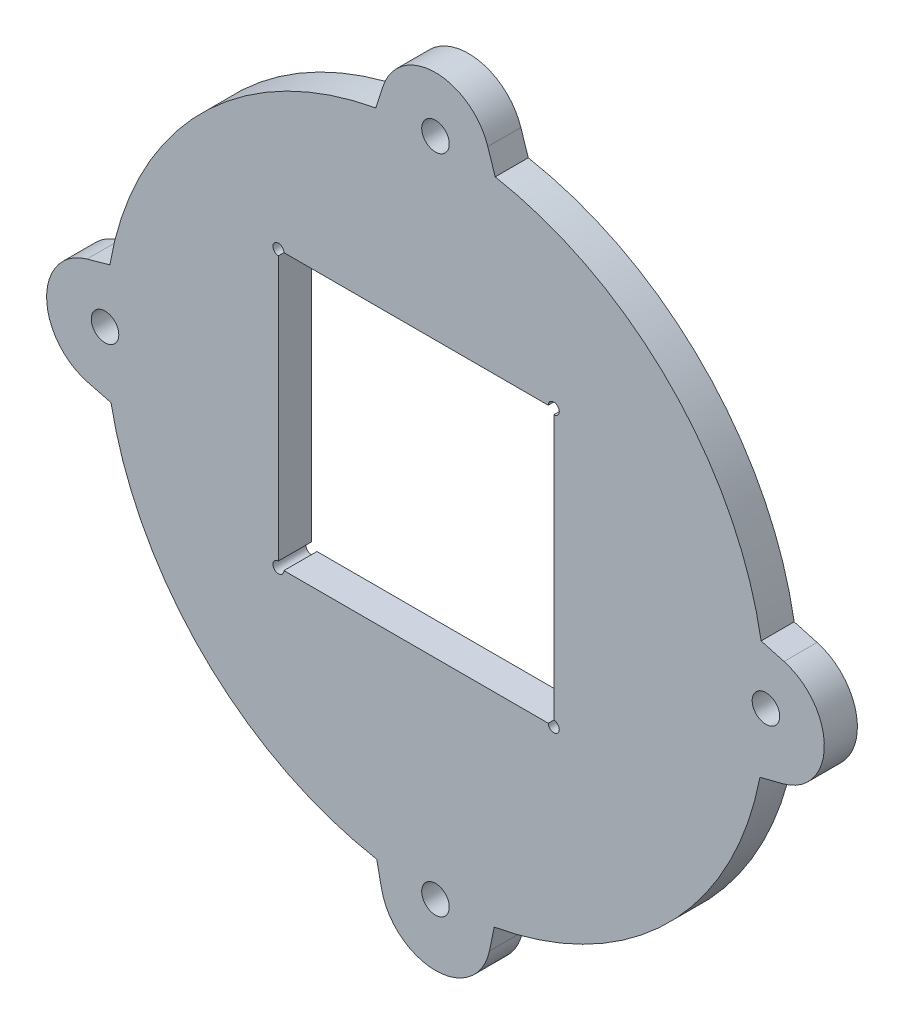
from build123d import *

# Parameters (mm, degrees)
SKETCH1_R           = 1.25
SKETCH1_W           = 25
SKETCH1_H           = 25
BOSS_EXTRUDE1_DEPTH = 3
SKETCH2_R           = 0.5
CUT_EXTRUDE1_DEPTH  = 10


with BuildPart() as part:
    # Sketch1 → Boss-Extrude1 (new body)
    with BuildSketch(Plane.XY):
        with BuildLine():
            Line((-33.493285167, 0.446508601), (-31.415510561, 1.024623715))
            ThreePointArc((-31.415510561, 1.024623715), (-23.182278998, 17.025967209), (-7.273839084, 25.43730688))
            Line((-7.273839084, 25.43730688), (-6.60289237, 27.486988539))
            ThreePointArc((-6.60289237, 27.486988539), (-1.851003919, 30.931496286), (2.900884532, 27.486988539))
            Line((2.900884532, 27.486988539), (3.571831246, 25.43730688))
            ThreePointArc((3.571831246, 25.43730688), (19.48027116, 17.025967209), (27.713502723, 1.024623715))
            Line((27.713502723, 1.024623715), (29.791277328, 0.446508601))
            ThreePointArc((29.791277328, 0.446508601), (33.450753312, -4.42033938), (29.695002819, -9.21328336))
            Line((29.695002819, -9.21328336), (27.606118503, -9.749871384))
            ThreePointArc((27.606118503, -9.749871384), (19.237844301, -25.405337611), (3.485623043, -33.590028279))
            Line((3.485623043, -33.590028279), (3.042149644, -35.700643293))
            ThreePointArc((3.042149644, -35.700643293), (-1.851003919, -39.672514797), (-6.744157483, -35.700643293))
            Line((-6.744157483, -35.700643293), (-7.187630881, -33.590028279))
            ThreePointArc((-7.187630881, -33.590028279), (-22.939852139, -25.405337611), (-31.308126341, -9.749871384))
            Line((-31.308126341, -9.749871384), (-33.397010658, -9.21328336))
            ThreePointArc((-33.397010658, -9.21328336), (-37.152761151, -4.42033938), (-33.493285167, 0.446508601))
        make_face()
        with Locations((-1.851003919, 25.931496286)):
            Circle(SKETCH1_R, mode=Mode.SUBTRACT)
        with Locations((28.148996081, -4.068503714)):
            Circle(SKETCH1_R, mode=Mode.SUBTRACT)
        with Locations((-1.851003919, -34.068503714)):
            Circle(SKETCH1_R, mode=Mode.SUBTRACT)
        with Locations((-31.851003919, -4.068503714)):
            Circle(SKETCH1_R, mode=Mode.SUBTRACT)
        with Locations((-3.613074624, -2.60843855)):
            Rectangle(SKETCH1_W, SKETCH1_H, mode=Mode.SUBTRACT)
    extrude(amount=BOSS_EXTRUDE1_DEPTH)

    # Sketch2 → Cut-Extrude1 (cut)
    with BuildSketch(Plane.XY.offset(3)):
        with Locations((-16.113074624, 9.89156145)):
            Circle(SKETCH2_R)
        with Locations((8.886925376, 9.89156145)):
            Circle(SKETCH2_R)
        with Locations((8.886925376, -15.10843855)):
            Circle(SKETCH2_R)
        with Locations((-16.113074624, -15.10843855)):
            Circle(SKETCH2_R)
    extrude(amount=-CUT_EXTRUDE1_DEPTH, mode=Mode.SUBTRACT)


solid = part.part
